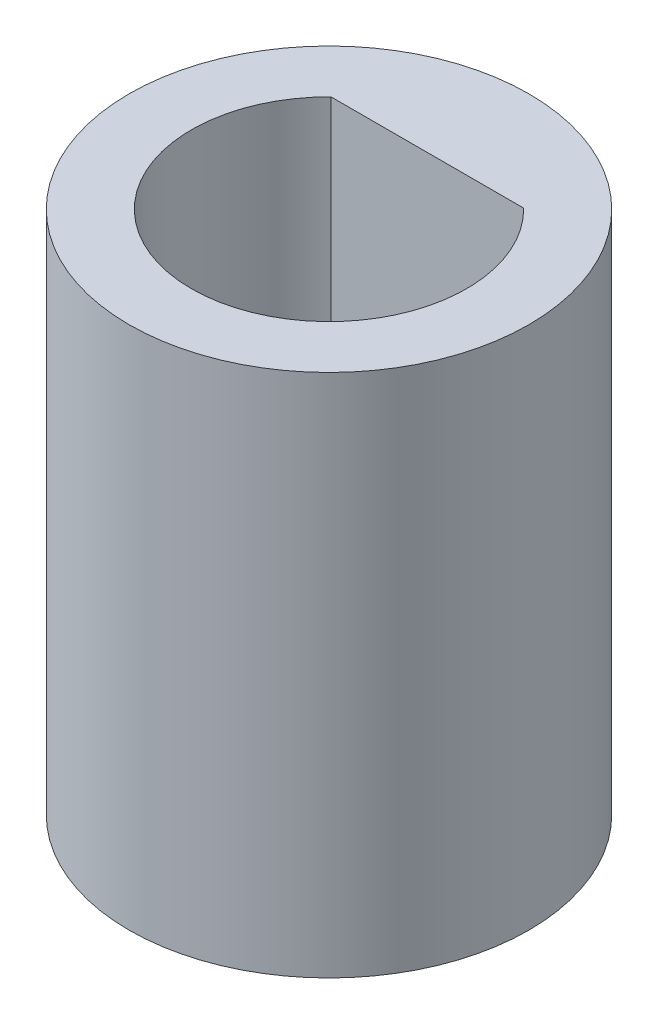
from build123d import *

# Parameters (mm, degrees)
SKETCH1_R           = 3.05
BOSS_EXTRUDE1_DEPTH = 8


with BuildPart() as part:
    # Sketch1 → Boss-Extrude1 (new body)
    with BuildSketch(Plane(origin=(0, 0, 0), x_dir=(1, 0, 0), z_dir=(0, 1, 0))):
        with Locations(Location((0, 0, 0), (0, 0, 270))):
            Circle(SKETCH1_R)
        with BuildLine():
            Line((-1.469693846, 1.5), (1.469693846, 1.5))
            ThreePointArc((1.469693846, 1.5), (0, -2.1), (-1.469693846, 1.5))
        make_face(mode=Mode.SUBTRACT)
    extrude(amount=BOSS_EXTRUDE1_DEPTH)


solid = part.part
